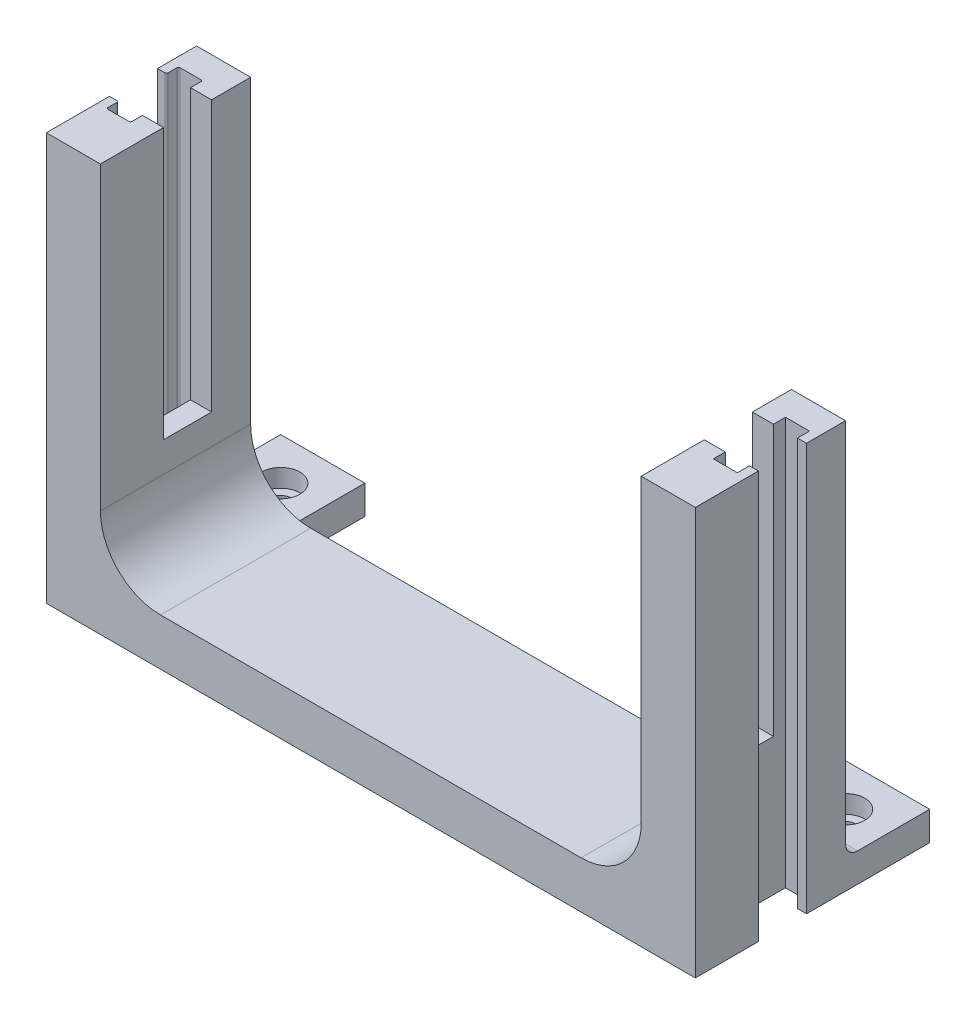
from build123d import *

# Parameters (mm, degrees)
BOSS_EXTRUDE1_DEPTH = 15
CUT_EXTRUDE1_DEPTH  = 67.82
SKETCH3_W           = 3.5
SKETCH3_H           = 8
CUT_EXTRUDE2_DEPTH  = 45
FILLET1_R           = 0.25
BOSS_EXTRUDE2_DEPTH = 7
BOSS_EXTRUDE3_DEPTH = 3
FILLET2_R           = 10
SKETCH12_W          = 14
SKETCH12_H          = 4.82
BOSS_EXTRUDE4_DEPTH = 14
FILLET3_R           = 2


with BuildPart() as part:
    # Sketch1 → Boss-Extrude1 (new body)
    with BuildSketch(Plane.XY):
        Polygon((-54, 0), (54, 0), (54, 67.82), (45, 67.82), (45, 7.82), (-45, 7.82), (-45, 67.82), (-54, 67.82), align=None)
    extrude(amount=-BOSS_EXTRUDE1_DEPTH)

    # Sketch2 → Cut-Extrude1 (cut)
    with BuildSketch(Plane(origin=(0, 67.82, 0), x_dir=(1, 0, 0), z_dir=(0, 1, 0))):
        Polygon((-54, 11.5), (-52.5, 11.5), (-52.5, 13.5), (-48.5, 13.5), (-48.5, 1.5), (-52.5, 1.5), (-52.5, 3.5), (-54, 3.5), align=None)
    cut_extrude1 = extrude(amount=-CUT_EXTRUDE1_DEPTH, mode=Mode.SUBTRACT)

    # Sketch3 → Cut-Extrude2 (cut)
    with BuildSketch(Plane(origin=(0, 67.82, 0), x_dir=(1, 0, 0), z_dir=(0, 1, 0))):
        with Locations((-46.75, 7.5)):
            Rectangle(SKETCH3_W, SKETCH3_H)
    cut_extrude2 = extrude(amount=-CUT_EXTRUDE2_DEPTH, mode=Mode.SUBTRACT)

    # Fillet1
    fillet1_edges = [part.edges().sort_by_distance(p)[0] for p in [
        (-52.5, 33.91, -3.5),
        (-52.5, 33.91, -1.5),
        (-48.5, 33.91, -1.5),
        (-48.5, 33.91, -13.5),
        (-52.5, 33.91, -13.5),
        (-52.5, 33.91, -11.5),
    ]]
    fillet(fillet1_edges, radius=FILLET1_R)

    # Mirror1: Cut-Extrude1 across plane
    add(cut_extrude1.mirror(Plane(origin=(0, 0, 0), x_dir=(0, 0, 1), z_dir=(1, 0, 0))), mode=Mode.SUBTRACT)

    # Mirror2: Cut-Extrude2 across plane
    add(cut_extrude2.mirror(Plane(origin=(0, 0, 0), x_dir=(0, 0, 1), z_dir=(1, 0, 0))), mode=Mode.SUBTRACT)

    # Sketch7 → Boss-Extrude2 (add)
    with BuildSketch(Plane.XY):
        Polygon((-54, 67.82), (-54, 0), (54, 0), (54, 67.82), (45, 67.82), (45, 7.82), (-45, 7.82), (-45, 67.82), align=None)
    extrude(amount=BOSS_EXTRUDE2_DEPTH)

    # Sketch11 → Boss-Extrude3 (add)
    with BuildSketch(Plane(origin=(0, 0, -15), x_dir=(-1, 0, 0), z_dir=(0, 0, -1))):
        Polygon((54, 0), (54, 67.82), (45, 67.82), (45, 7.82), (-45, 7.82), (-45, 67.82), (-54, 67.82), (-54, 0), align=None)
    extrude(amount=BOSS_EXTRUDE3_DEPTH)

    # Fillet2
    fillet2_edges = [part.edges().sort_by_distance(p)[0] for p in [
        (-45, 7.82, -5.5),
        (45, 7.82, -5.5),
    ]]
    fillet(fillet2_edges, radius=FILLET2_R)

    # Sketch12 → Boss-Extrude4 (add)
    with BuildSketch(Plane.XY.offset(-18)):
        with Locations((-47, 2.41)):
            Rectangle(SKETCH12_W, SKETCH12_H)
        with Locations((47, 2.41)):
            Rectangle(SKETCH12_W, SKETCH12_H)
    extrude(amount=-BOSS_EXTRUDE4_DEPTH)

    # Sketch13 → Cut-Revolve1 (revolve, cut)
    with BuildSketch(Plane.ZY.offset(47)):
        Polygon((-25, 4.82), (-25, 0), (-23.26, 0), (-23.26, 1.82), (-21.8, 1.82), (-21.8, 4.82), align=None)
    cut_revolve1 = revolve(axis=Axis((-47, 4.82, -25), (0, -1, 0)), mode=Mode.SUBTRACT)

    # Mirror3: Cut-Revolve1 across plane
    add(cut_revolve1.mirror(Plane(origin=(0, 0, 0), x_dir=(0, 0, 1), z_dir=(1, 0, 0))), mode=Mode.SUBTRACT)

    # Fillet3
    fillet3_edges = [part.edges().sort_by_distance(p)[0] for p in [
        (-47, 4.82, -18),
        (47, 4.82, -18),
    ]]
    fillet(fillet3_edges, radius=FILLET3_R)


solid = part.part
